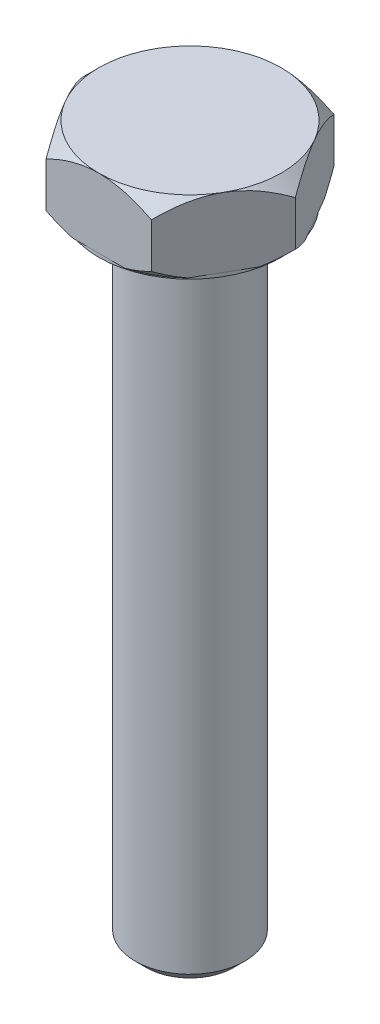
from build123d import *

# Parameters (mm, degrees)
BOSS_EXTRUDE1_DEPTH = 4
SKETCH2_OUTSIDE_W   = 16.706
SKETCH2_OUTSIDE_H   = 15.158
SKETCH2_OUTSIDE_R   = 5
CUT_EXTRUDE1_DEPTH  = 0.2
SKETCH3_R           = 3
BOSS_EXTRUDE2_DEPTH = 35
CHAMFER1_SIZE       = 0.6


with BuildPart() as part:
    # Sketch1 → Boss-Extrude1 (new body)
    with BuildSketch(Plane(origin=(0, 0, 0), x_dir=(1, 0, 0), z_dir=(0, 1, 0))):
        Polygon((5.773502692, 0), (2.886751346, 5), (-2.886751346, 5), (-5.773502692, 0), (-2.886751346, -5), (2.886751346, -5), align=None)
    extrude(amount=-BOSS_EXTRUDE1_DEPTH)

    # Sketch4 → Cut-Revolve1 (revolve, cut)
    with BuildSketch(Plane(origin=(0, 0, 0), x_dir=(0, 0, -1), z_dir=(1, 0, 0))):
        Polygon((-5, 0), (-6, 0), (-6, -1), align=None)
        Polygon((-6, -3), (-5, -4), (-6, -4), align=None)
    revolve(axis=Axis((0, 0, 0), (0, -1, 0)), mode=Mode.SUBTRACT)

    # Sketch2 outside → Cut-Extrude1 (cut)
    with BuildSketch(Plane.XZ.offset(4)):
        Rectangle(SKETCH2_OUTSIDE_W, SKETCH2_OUTSIDE_H)
        with Locations(Location((0, 0, 0), (0, 0, 90))):
            Circle(SKETCH2_OUTSIDE_R, mode=Mode.SUBTRACT)
    extrude(amount=-CUT_EXTRUDE1_DEPTH, mode=Mode.SUBTRACT)

    # Sketch3 → Boss-Extrude2 (add)
    with BuildSketch(Plane.XZ.offset(4)):
        with Locations(Location((0, 0, 0), (0, 0, 90))):
            Circle(SKETCH3_R)
    extrude(amount=BOSS_EXTRUDE2_DEPTH)

    # Chamfer1
    chamfer1_edges = [part.edges().sort_by_distance(p)[0] for p in [
        (0, -39, -3),
    ]]
    chamfer(chamfer1_edges, length=CHAMFER1_SIZE)


solid = part.part
